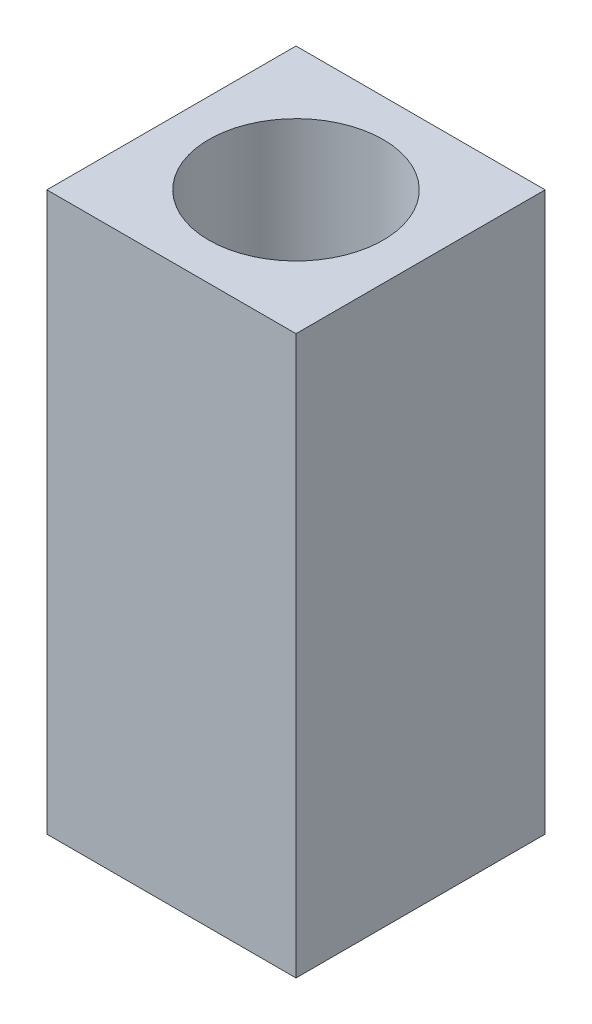
from build123d import *

# Parameters (mm, degrees)
SZKIC1_W                    = 5
SZKIC1_H                    = 5
SZKIC1_R                    = 1.75
DODANIE_WYCI_GNI_CIE1_DEPTH = 11.2


with BuildPart() as part:
    # Szkic1 → Dodanie-wyciągnięcie1 (new body)
    with BuildSketch(Plane(origin=(0, 0, 0), x_dir=(1, 0, 0), z_dir=(0, 1, 0))):
        Rectangle(SZKIC1_W, SZKIC1_H)
        with Locations(Location((0, 0, 0), (0, 0, 270))):
            Circle(SZKIC1_R, mode=Mode.SUBTRACT)
    extrude(amount=DODANIE_WYCI_GNI_CIE1_DEPTH)


solid = part.part
